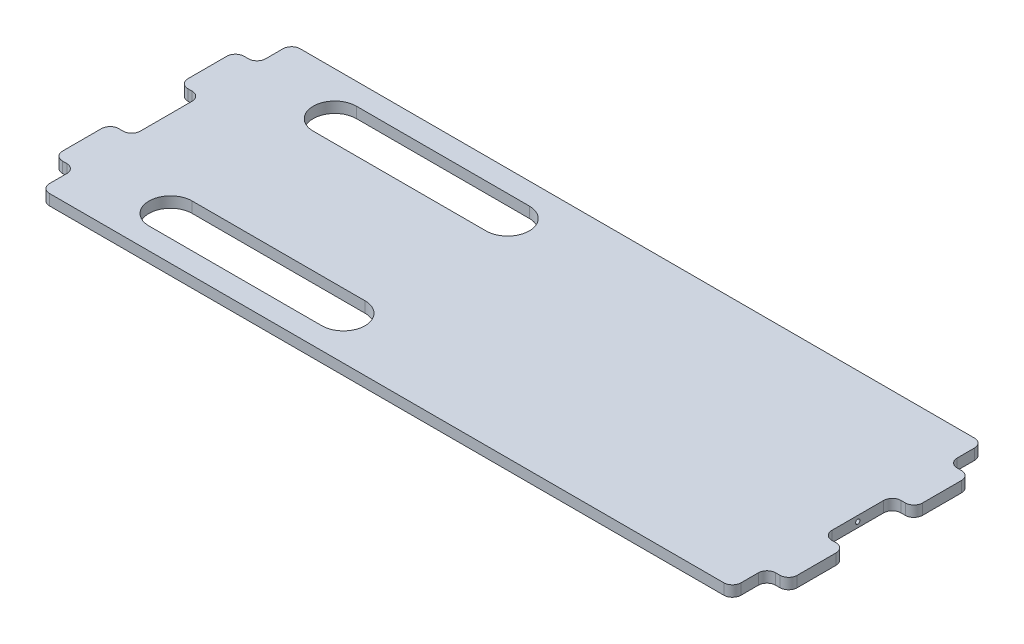
from build123d import *

# Parameters (mm, degrees)
BOSS_EXTRUDE1_DEPTH = 3.175
FILLET1_R           = 2.54
SKETCH3_R           = 0.635
CUT_EXTRUDE1_DEPTH  = 213.785648071


with BuildPart() as part:
    # Sketch1 → Boss-Extrude1 (new body)
    with BuildSketch(Plane(origin=(0, 0, 0), x_dir=(1, 0, 0), z_dir=(0, 1, 0))):
        Polygon((-101.6, 36.83), (101.6, 36.83), (101.6, 26.67), (107.95, 26.67), (107.95, 10.16), (101.6, 10.16), (101.6, -10.16), (107.95, -10.16), (107.95, -26.67), (101.6, -26.67), (101.6, -36.83), (-101.6, -36.83), (-101.6, -26.67), (-107.95, -26.67), (-107.95, -10.16), (-101.6, -10.16), (-101.6, 10.16), (-107.95, 10.16), (-107.95, 26.67), (-101.6, 26.67), align=None)
        with BuildLine():
            Line((-76.2, -17.78), (-25.4, -17.78))
            ThreePointArc((-25.4, -17.78), (-19.05, -24.13), (-25.4, -30.48))
            Line((-25.4, -30.48), (-76.2, -30.48))
            ThreePointArc((-76.2, -30.48), (-82.55, -24.13), (-76.2, -17.78))
        make_face(mode=Mode.SUBTRACT)
        with BuildLine():
            Line((-76.2, 17.78), (-25.4, 17.78))
            ThreePointArc((-25.4, 17.78), (-19.05, 24.13), (-25.4, 30.48))
            Line((-25.4, 30.48), (-76.2, 30.48))
            ThreePointArc((-76.2, 30.48), (-82.55, 24.13), (-76.2, 17.78))
        make_face(mode=Mode.SUBTRACT)
    extrude(amount=BOSS_EXTRUDE1_DEPTH)

    # Fillet1
    fillet1_edges = [part.edges().sort_by_distance(p)[0] for p in [
        (101.6, 1.5875, 36.83),
        (-101.6, 1.5875, 36.83),
        (-101.6, 1.5875, 26.67),
        (-107.95, 1.5875, 26.67),
        (-107.95, 1.5875, 10.16),
        (-101.6, 1.5875, 10.16),
        (-101.6, 1.5875, -10.16),
        (-107.95, 1.5875, -10.16),
        (-107.95, 1.5875, -26.67),
        (-101.6, 1.5875, -26.67),
        (-101.6, 1.5875, -36.83),
        (101.6, 1.5875, -36.83),
        (101.6, 1.5875, -26.67),
        (107.95, 1.5875, -26.67),
        (107.95, 1.5875, -10.16),
        (101.6, 1.5875, -10.16),
        (101.6, 1.5875, 10.16),
        (107.95, 1.5875, 10.16),
        (107.95, 1.5875, 26.67),
        (101.6, 1.5875, 26.67),
    ]]
    fillet(fillet1_edges, radius=FILLET1_R)

    # Sketch3 → Cut-Extrude1 (cut, through all)
    with BuildSketch(Plane.ZY.offset(101.6)):
        with Locations((0, 1.5875)):
            Circle(SKETCH3_R)
    extrude(amount=-CUT_EXTRUDE1_DEPTH, mode=Mode.SUBTRACT)


solid = part.part
